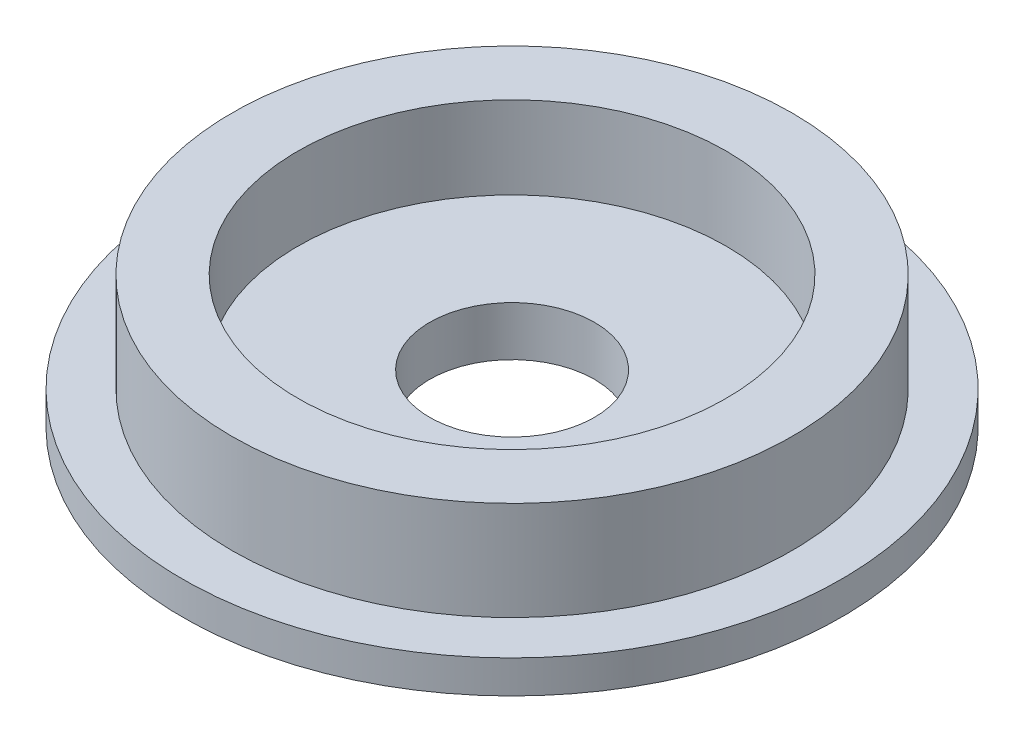
from build123d import *


with BuildPart() as part:
    # Sketch1 → Revolve1 (revolve)
    with BuildSketch(Plane(origin=(0, 0, 0), x_dir=(0, 0, -1), z_dir=(1, 0, 0)), mode=Mode.PRIVATE) as revolve1_sk:
        Polygon((-10, 1), (-8.5, 1), (-8.5, 4), (-6.5, 4), (-6.5, 1.5), (-2.5, 1.5), (-2.5, 0), (-7.4050124, 0), (-10, 0), align=None)
    revolve(revolve1_sk.sketch.rotate(Axis((0, 0, 0), (0, 1, 0)), 180), axis=Axis((0, 0, 0), (0, 1, 0)))


solid = part.part
